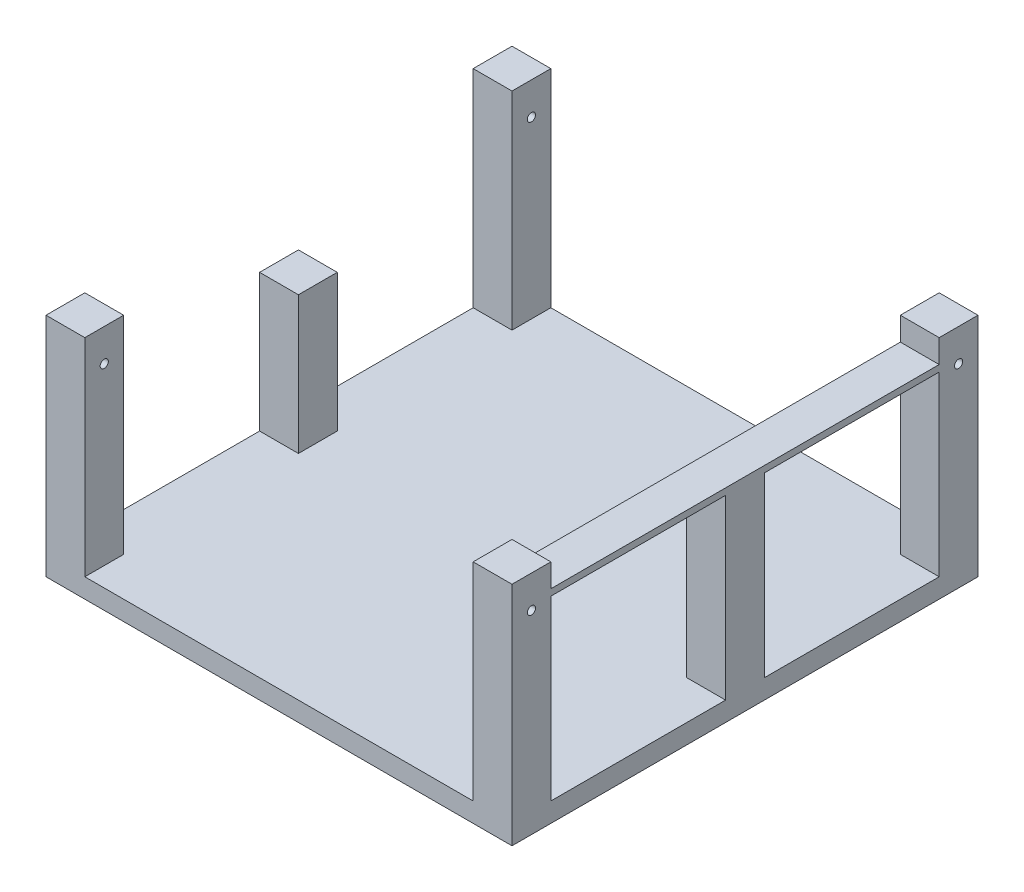
from build123d import *

# Parameters (mm, degrees)
SKETCH2_W           = 457.2
SKETCH2_H           = 457.2
BOSS_EXTRUDE1_DEPTH = 19.05
SKETCH3_W           = 38.1
SKETCH3_H           = 38.1
BOSS_EXTRUDE2_DEPTH = 203.2
SKETCH4_R           = 4
CUT_EXTRUDE1_DEPTH  = 457.2
SKETCH6_W           = 38.1
SKETCH6_H           = 38.1
BOSS_EXTRUDE3_DEPTH = 134.874
SKETCH7_W           = 38.1
SKETCH7_H           = 38.1
BOSS_EXTRUDE4_DEPTH = 173.99
SKETCH8_W           = 38.1
SKETCH8_H           = 381
BOSS_EXTRUDE5_DEPTH = 6.35


with BuildPart() as part:
    # Sketch2 → Boss-Extrude1 (new body)
    with BuildSketch(Plane(origin=(0, 0, 0), x_dir=(1, 0, 0), z_dir=(0, 1, 0))):
        Rectangle(SKETCH2_W, SKETCH2_H)
    extrude(amount=BOSS_EXTRUDE1_DEPTH)

    # Sketch3 → Boss-Extrude2 (add)
    with BuildSketch(Plane(origin=(0, 19.05, 0), x_dir=(1, 0, 0), z_dir=(0, 1, 0))):
        with Locations((209.55, 209.55)):
            Rectangle(SKETCH3_W, SKETCH3_H)
        with Locations((-209.55, 209.55)):
            Rectangle(SKETCH3_W, SKETCH3_H)
        with Locations((-209.55, -209.55)):
            Rectangle(SKETCH3_W, SKETCH3_H)
        with Locations((209.55, -209.55)):
            Rectangle(SKETCH3_W, SKETCH3_H)
    extrude(amount=BOSS_EXTRUDE2_DEPTH)

    # Sketch4 → Cut-Extrude1 (cut)
    with BuildSketch(Plane.ZY.offset(228.6)):
        with Locations((-209.55, 190.5)):
            Circle(SKETCH4_R)
        with Locations(Location((209.55, 190.5, 0), (0, 0, 180))):
            Circle(SKETCH4_R)
    extrude(amount=-CUT_EXTRUDE1_DEPTH, mode=Mode.SUBTRACT)

    # Sketch6 → Boss-Extrude3 (add)
    with BuildSketch(Plane(origin=(0, 19.05, 0), x_dir=(1, 0, 0), z_dir=(0, 1, 0))):
        with Locations((-209.55, 0)):
            Rectangle(SKETCH6_W, SKETCH6_H)
    extrude(amount=BOSS_EXTRUDE3_DEPTH)

    # Sketch7 → Boss-Extrude4 (add)
    with BuildSketch(Plane(origin=(0, 19.05, 0), x_dir=(1, 0, 0), z_dir=(0, 1, 0))):
        with Locations((209.55, 0)):
            Rectangle(SKETCH7_W, SKETCH7_H)
    extrude(amount=BOSS_EXTRUDE4_DEPTH)

    # Sketch8 → Boss-Extrude5 (add)
    with BuildSketch(Plane(origin=(0, 193.04, 0), x_dir=(1, 0, 0), z_dir=(0, 1, 0))):
        with Locations((209.55, 0)):
            Rectangle(SKETCH8_W, SKETCH8_H)
    extrude(amount=BOSS_EXTRUDE5_DEPTH)


solid = part.part
